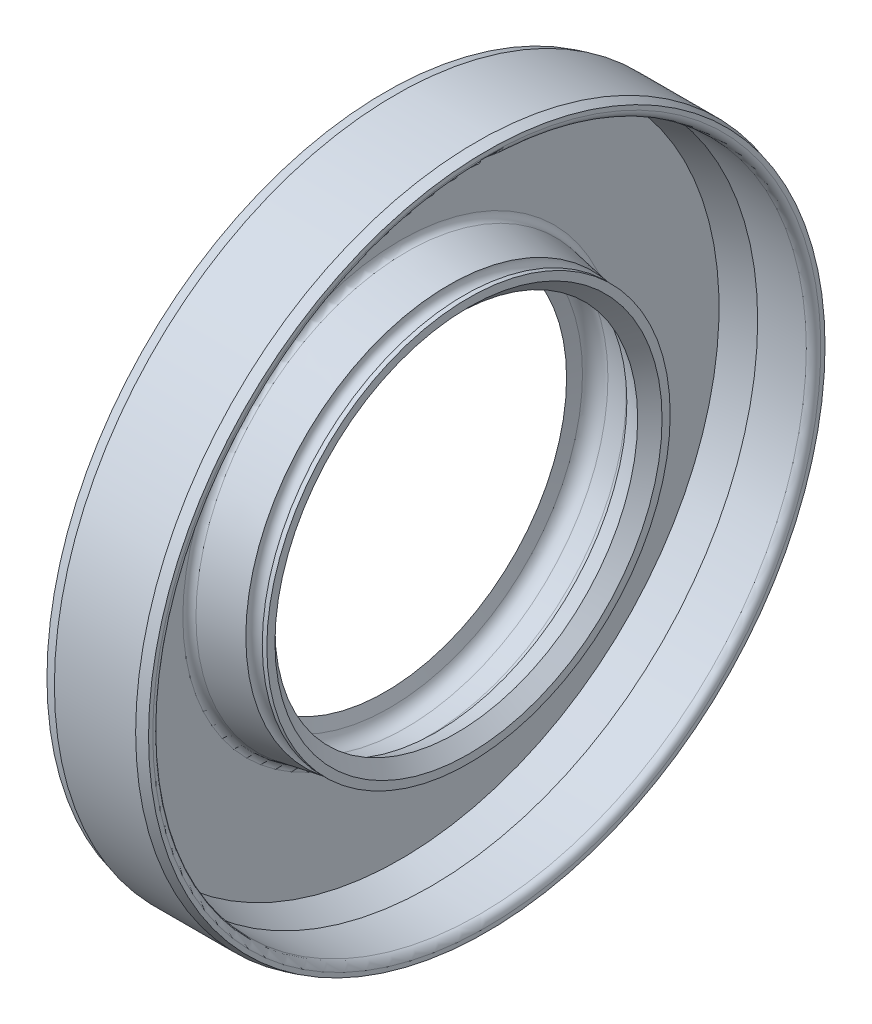
from build123d import *
from build123d.topology import SkipClean

# Parameters (mm, degrees)
SKICA2_R                 = 20.5
SKICA2_R_2               = 16.5
ODEBRAT_VYSUNUT_M1_DEPTH = 0.1
ODEBRAT_VYSUNUT_M2_DEPTH = 0.1


with BuildPart() as part:
    # Skica1 → Rotovat1 (revolve)
    with BuildSketch(Plane(origin=(0, 0, 0), x_dir=(1, 0, 0), z_dir=(0, 1, 0)), mode=Mode.PRIVATE) as rotovat1_sk:
        with BuildLine():
            Line((7, 23.312435565), (6.3, 23.5))
            Line((6.3, 23.5), (0.7, 23.5))
            Line((0.7, 23.5), (0, 23.312435565))
            Line((0, 23.312435565), (0, 14.610424137))
            Line((0, 14.610424137), (0, 12.5))
            Line((0, 12.5), (0.294402587, 13.30243551))
            ThreePointArc((0.294402587, 13.30243551), (0.734326594, 13.824666936), (1.406860422, 13.942806871))
            Line((1.406860422, 13.942806871), (2.942553724, 13.672022708))
            ThreePointArc((2.942553724, 13.672022708), (3.298086623, 13.494895852), (3.5, 13.152830721))
            Line((3.5, 13.152830721), (4.9, 12.5))
            Line((4.9, 12.5), (5.74, 13.34))
            Line((5.74, 13.34), (5.74, 13.9))
            Line((5.74, 13.9), (5.424982458, 13.9))
            ThreePointArc((5.424982458, 13.9), (4.854244761, 13.377215727), (4.382958388, 13.991165293))
            Line((4.382958388, 13.991165293), (1.463158369, 14.506004815))
            ThreePointArc((1.463158369, 14.506004815), (1.166960236, 14.677014886), (1.049982458, 14.998408691))
            Line((1.049982458, 14.998408691), (1.049982458, 21.957306696))
            Line((1.049982458, 21.957306696), (3.149982458, 22.52))
            Line((3.149982458, 22.52), (6.499982458, 22.52))
            ThreePointArc((6.499982458, 22.52), (6.853547189, 22.666440407), (7, 23.02))
            Line((7, 23.02), (7, 23.312435565))
        make_face()
    revolve(rotovat1_sk.sketch.rotate(Axis((0, 0, 0), (1, 0, 0)), 180), axis=Axis((0, 0, 0), (1, 0, 0)))

    # Skica2 → Odebrat vysunutím1 (cut)
    with BuildSketch(Plane.ZY):
        Circle(SKICA2_R)
        Circle(SKICA2_R_2, mode=Mode.SUBTRACT)
    extrude(amount=-ODEBRAT_VYSUNUT_M1_DEPTH, mode=Mode.SUBTRACT)

    # Skica3 → Odebrat vysunutím2 (cut)
    with SkipClean():  # the faces are left unmerged after this step: merging them gives an invalid solid
        with BuildSketch(Plane.ZY.offset(-0.1)):
            with BuildLine():
                Line((16.95593121, 11.521562256), (13.480249471, 9.514876468))
                ThreePointArc((13.480249471, 9.514876468), (14.289419162, 8.25), (14.980249471, 6.916800257))
                Line((14.980249471, 6.916800257), (18.45593121, 8.923486044))
                ThreePointArc((18.45593121, 8.923486044), (17.753520778, 10.25), (16.95593121, 11.521562256))
            make_face()
            with BuildLine():
                Line((-1.5, 20.4450483), (-1.5, 16.431676725))
                ThreePointArc((-1.5, 16.431676725), (0, 16.5), (1.5, 16.431676725))
                Line((1.5, 16.431676725), (1.5, 20.4450483))
                ThreePointArc((1.5, 20.4450483), (0, 20.5), (-1.5, 20.4450483))
            make_face()
            with BuildLine():
                Line((18.45593121, -8.923486044), (14.980249471, -6.916800257))
                ThreePointArc((14.980249471, -6.916800257), (14.289419162, -8.25), (13.480249471, -9.514876468))
                Line((13.480249471, -9.514876468), (16.95593121, -11.521562256))
                ThreePointArc((16.95593121, -11.521562256), (17.753520778, -10.25), (18.45593121, -8.923486044))
            make_face()
            with BuildLine():
                Line((1.5, -20.4450483), (1.5, -16.431676725))
                ThreePointArc((1.5, -16.431676725), (0, -16.5), (-1.5, -16.431676725))
                Line((-1.5, -16.431676725), (-1.5, -20.4450483))
                ThreePointArc((-1.5, -20.4450483), (0, -20.5), (1.5, -20.4450483))
            make_face()
            with BuildLine():
                Line((-16.95593121, -11.521562256), (-13.480249471, -9.514876468))
                ThreePointArc((-13.480249471, -9.514876468), (-14.289419162, -8.25), (-14.980249471, -6.916800257))
                Line((-14.980249471, -6.916800257), (-18.45593121, -8.923486044))
                ThreePointArc((-18.45593121, -8.923486044), (-17.753520778, -10.25), (-16.95593121, -11.521562256))
            make_face()
            with BuildLine():
                Line((-18.45593121, 8.923486044), (-14.980249471, 6.916800257))
                ThreePointArc((-14.980249471, 6.916800257), (-14.289419162, 8.25), (-13.480249471, 9.514876468))
                Line((-13.480249471, 9.514876468), (-16.95593121, 11.521562256))
                ThreePointArc((-16.95593121, 11.521562256), (-17.753520778, 10.25), (-18.45593121, 8.923486044))
            make_face()
        extrude(amount=-ODEBRAT_VYSUNUT_M2_DEPTH, mode=Mode.SUBTRACT)


solid = part.part
